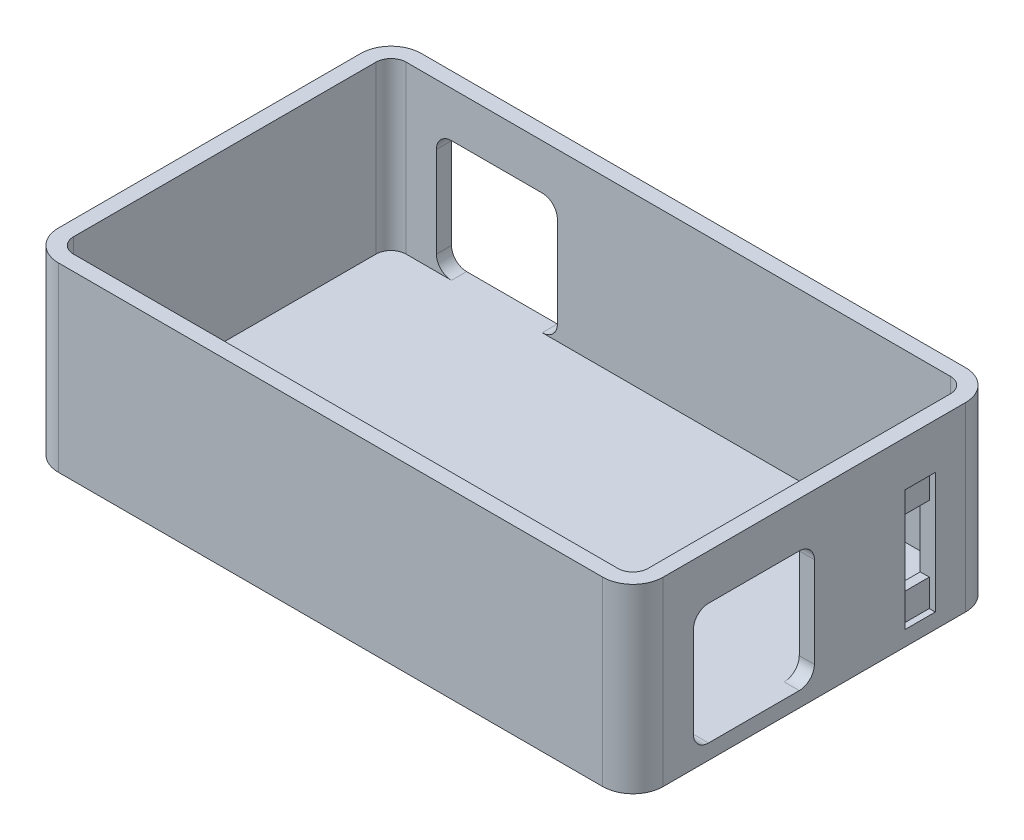
from build123d import *

# Parameters (mm, degrees)
SKETCH1_W          = 100
SKETCH1_H          = 60
BASE_DEPTH         = 30
FILLET1_R          = 5
SHELL1_T           = -2.5
CUT_EXTRUDE1_REACH = 110.628
SKETCH2_W          = 20
SKETCH2_H          = 20
FILLET2_R          = 2.5
CUT_EXTRUDE2_REACH = 102.743
SKETCH4_W          = 20
SKETCH4_H          = 20
FILLET3_R          = 2.5
SKETCH5_W          = 5
SKETCH5_H          = 20
CUT_EXTRUDE3_DEPTH = 1
CUT_EXTRUDE5_REACH = 109.708
SKETCH8_W          = 5
SKETCH8_H          = 11


with BuildPart() as part:
    # Sketch1 → Base (new body)
    with BuildSketch(Plane(origin=(0, 0, 0), x_dir=(1, 0, 0), z_dir=(0, 1, 0))):
        Rectangle(SKETCH1_W, SKETCH1_H)
    extrude(amount=BASE_DEPTH)

    # Fillet1
    fillet1_edges = [part.edges().sort_by_distance(p)[0] for p in [
        (50, 15, -30),
        (50, 15, 30),
        (-50, 15, 30),
        (-50, 15, -30),
    ]]
    fillet(fillet1_edges, radius=FILLET1_R)

    # Shell1
    shell1_openings = [part.faces().sort_by_distance(p)[0] for p in [
        (0, 30, 0),
    ]]
    offset(amount=SHELL1_T, openings=shell1_openings, kind=Kind.INTERSECTION)

    # Sketch2 → Cut-Extrude1 (cut, up to next)
    with BuildSketch(Plane(origin=(50, 0, 0), x_dir=(0, 0, -1), z_dir=(1, 0, 0)), mode=Mode.PRIVATE) as cut_extrude1_sk1:
        with Locations((-10, 12.5)):
            Rectangle(SKETCH2_W, SKETCH2_H)
    cut_extrude1_tool1 = extrude(cut_extrude1_sk1.sketch, amount=-CUT_EXTRUDE1_REACH, mode=Mode.PRIVATE) & part.part
    add(cut_extrude1_tool1.solids().sort_by_distance((50, 12.5, 10))[0], mode=Mode.SUBTRACT)

    # Fillet2
    fillet2_edges = [part.edges().sort_by_distance(p)[0] for p in [
        (48.75, 2.5, 20),
        (48.75, 2.5, 0),
        (48.75, 22.5, 0),
        (48.75, 22.5, 20),
    ]]
    fillet(fillet2_edges, radius=FILLET2_R)

    # Sketch4 → Cut-Extrude2 (cut, up to next)
    with BuildSketch(Plane(origin=(-26.934652874, 4.896122142, -30), x_dir=(-1, 0, 0), z_dir=(0, 0, -1)), mode=Mode.PRIVATE) as cut_extrude2_sk1:
        with Locations((3.065347126, 7.603877858)):
            Rectangle(SKETCH4_W, SKETCH4_H)
    cut_extrude2_tool1 = extrude(cut_extrude2_sk1.sketch, amount=-CUT_EXTRUDE2_REACH, mode=Mode.PRIVATE) & part.part
    add(cut_extrude2_tool1.solids().sort_by_distance((-30, 12.5, -30))[0], mode=Mode.SUBTRACT)

    # Fillet3
    fillet3_edges = [part.edges().sort_by_distance(p)[0] for p in [
        (-20, 2.5, -28.75),
        (-40, 2.5, -28.75),
        (-40, 22.5, -28.75),
        (-20, 22.5, -28.75),
    ]]
    fillet(fillet3_edges, radius=FILLET3_R)

    # Sketch5 → Cut-Extrude3 (cut)
    with BuildSketch(Plane(origin=(50, 0, 0), x_dir=(0, 0, -1), z_dir=(1, 0, 0))):
        with Locations((17.5, 12.5)):
            Rectangle(SKETCH5_W, SKETCH5_H)
    extrude(amount=-CUT_EXTRUDE3_DEPTH, mode=Mode.SUBTRACT)

    # Sketch8 → Cut-Extrude5 (cut, up to next)
    with BuildSketch(Plane(origin=(49, 0, 0), x_dir=(0, 0, -1), z_dir=(1, 0, 0)), mode=Mode.PRIVATE) as cut_extrude5_sk1:
        with Locations((17.5, 12.5)):
            Rectangle(SKETCH8_W, SKETCH8_H)
    cut_extrude5_tool1 = extrude(cut_extrude5_sk1.sketch, amount=-CUT_EXTRUDE5_REACH, mode=Mode.PRIVATE) & part.part
    add(cut_extrude5_tool1.solids().sort_by_distance((49, 12.5, -17.5))[0], mode=Mode.SUBTRACT)


solid = part.part
